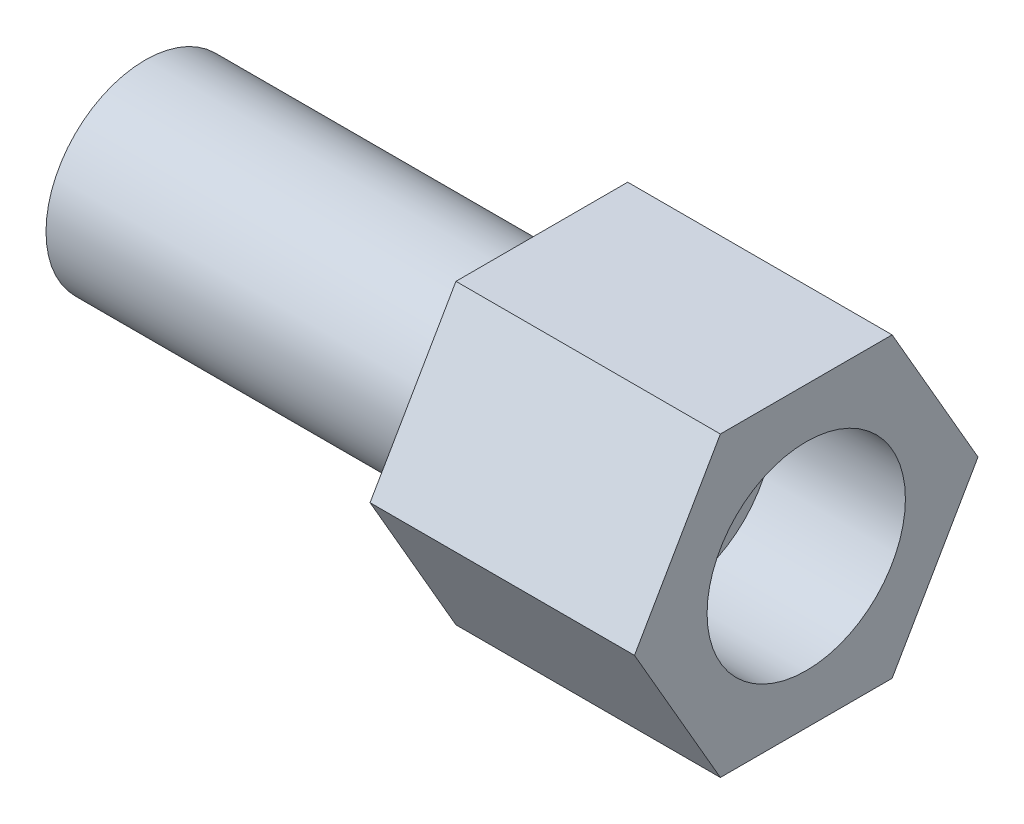
from build123d import *

# Parameters (mm, degrees)
SKETCH_1_R          = 1.5
EXTRUDE_1_DEPTH     = 6
EXTRUDE_2_DEPTH     = 4
CUT_EXTRUDE_START   = -2
SKETCH_4_R          = 1.5
CUT_EXTRUDE_1_DEPTH = 2


with BuildPart() as part:
    # 草图1 → 凸台-拉伸1 (new body)
    with BuildSketch(Plane(origin=(0, 0, 0), x_dir=(0, 0, -1), z_dir=(1, 0, 0))):
        Circle(SKETCH_1_R)
    extrude(amount=EXTRUDE_1_DEPTH)

    # 草图2 → 凸台-拉伸2 (add)
    with BuildSketch(Plane(origin=(6, 0, 0), x_dir=(0, 0, -1), z_dir=(1, 0, 0))):
        Polygon((2.598076211, 0), (1.299038106, 2.25), (-1.299038106, 2.25), (-2.598076211, 0), (-1.299038106, -2.25), (1.299038106, -2.25), align=None)
    extrude(amount=EXTRUDE_2_DEPTH)

    # 草图4 → 切除-拉伸1 (cut)
    with BuildSketch(Plane(origin=(10, 0, 0), x_dir=(0, 0, -1), z_dir=(1, 0, 0)).offset(CUT_EXTRUDE_START)):
        Circle(SKETCH_4_R)
    extrude(amount=CUT_EXTRUDE_1_DEPTH, mode=Mode.SUBTRACT)


solid = part.part
